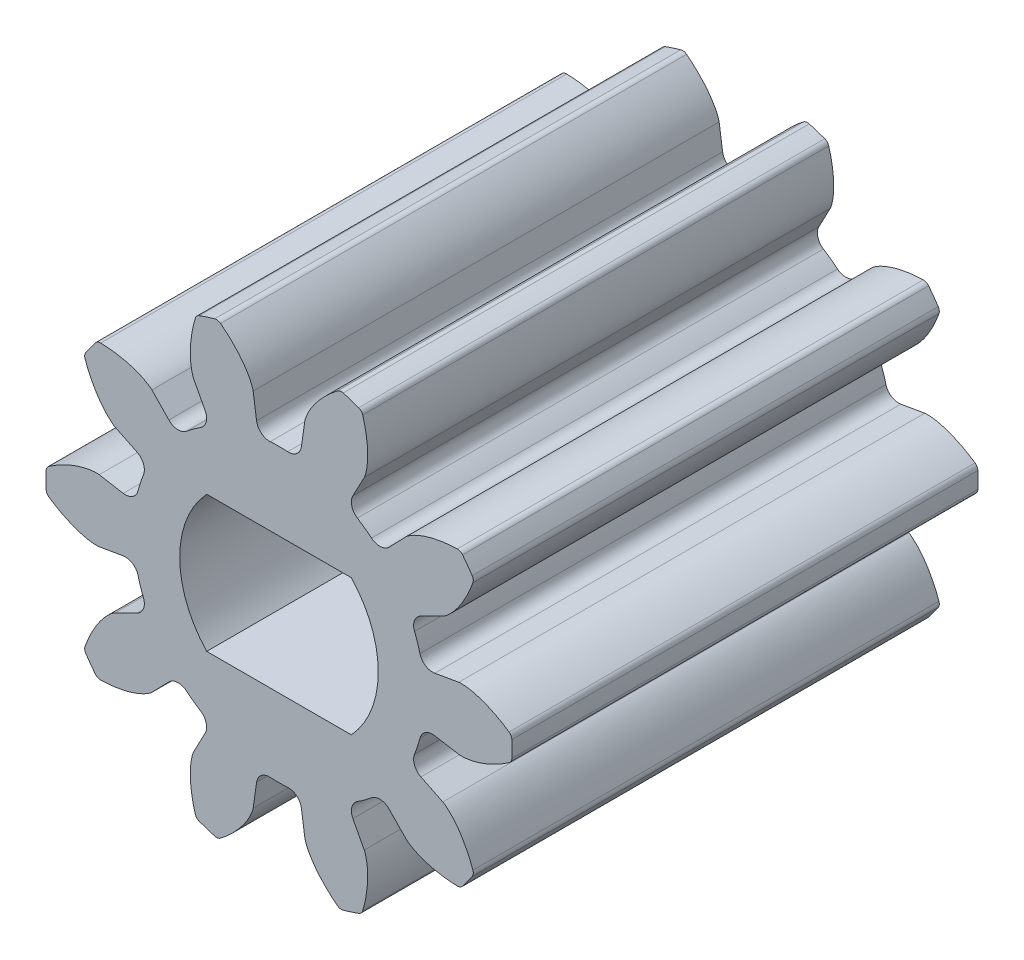
from build123d import *

# Parameters (mm, degrees)
SKETCH1_R                                 = 6.35
BOSS_EXTRUDE1_DEPTH                       = 12.7
CUT_EXTRUDE_DCLTBC_DEPTH                  = 16.554259867
FILLET_TIP_DCLTBC_R                       = 0.177538081
FILLET_ROOT_DCLTBC_R                      = 0.355076163
CIRPATTERN_DCLTBC_COUNT                   = 10
FILLET_TIP_DCLTBC_OF_CIRPATTERN_DCLTBC_R  = 0.177538081
FILLET_ROOT_DCLTBC_OF_CIRPATTERN_DCLTBC_R = 0.355076163
CUT_EXTRUDE2_DEPTH                        = 16.458216095


with BuildPart() as part:
    # Sketch1 → Boss-Extrude1 (new body)
    with BuildSketch(Plane.XY):
        Circle(SKETCH1_R)
    extrude(amount=BOSS_EXTRUDE1_DEPTH)

    # DCLTBC → Cut-Extrude-DCLTBC (cut, through all)
    with BuildSketch(Plane.XY):
        with BuildLine():
            Line((-0.704592769, 4.922367749), (-0.562358973, 3.92870576))
            ThreePointArc((-0.562358973, 3.92870576), (0, 3.96875), (0.562358973, 3.92870576))
            Line((0.562358973, 3.92870576), (0.704592769, 4.922367749))
            add(Edge.make_bspline(
                [(0.704592769, 4.922367749), (0.704959911, 4.924657652), (0.706108696, 4.931060486), (0.708749985, 4.9430835), (0.713722219, 4.962562731), (0.72102673, 4.987160391), (0.731572349, 5.01866565), (0.745406167, 5.05537935), (0.762074788, 5.095269011), (0.781776183, 5.138134197), (0.802804874, 5.18039699), (0.82504792, 5.222061634), (0.848339645, 5.263102092), (0.87787829, 5.312237624), (0.915131441, 5.370333793), (0.961301537, 5.436965609), (1.016733636, 5.510974525), (1.076438178, 5.584628915), (1.137804354, 5.65561363), (1.202739614, 5.72552362), (1.267642643, 5.791874617), (1.337964359, 5.858824087), (1.404363156, 5.919628028), (1.481874196, 5.98546848), (1.545347028, 6.037944392), (1.613447979, 6.090182881), (1.646963442, 6.115313985), (1.664246535, 6.128032594)],
                knots=[0, 0, 0, 0, 0, 0.005376749, 0.015083688, 0.02853182, 0.046610139, 0.064854849, 0.092110525, 0.119476176, 0.146842496, 0.174208854, 0.201574956, 0.228941013, 0.256307345, 0.307035032, 0.361767352, 0.41649966, 0.471231936, 0.525964282, 0.580696615, 0.635428982, 0.690161387, 0.744893688, 0.799626082, 0.854358408, 0.909090915, 0.909090915, 0.909090915, 0.909090915, 0.909090915], degree=4))
            ThreePointArc((1.664246535, 6.128032594), (0, 6.35), (-1.664246535, 6.128032594))
            add(Edge.make_bspline(
                [(-0.704592769, 4.922367749), (-0.704959911, 4.924657652), (-0.706108696, 4.931060486), (-0.708749985, 4.9430835), (-0.713722219, 4.962562731), (-0.72102673, 4.987160391), (-0.731572349, 5.01866565), (-0.745406167, 5.05537935), (-0.762074788, 5.095269011), (-0.781776183, 5.138134197), (-0.802804874, 5.18039699), (-0.82504792, 5.222061634), (-0.848339645, 5.263102092), (-0.87787829, 5.312237624), (-0.915131441, 5.370333793), (-0.961301537, 5.436965609), (-1.016733636, 5.510974525), (-1.076438178, 5.584628915), (-1.137804354, 5.65561363), (-1.202739614, 5.72552362), (-1.267642643, 5.791874617), (-1.337964359, 5.858824087), (-1.404363156, 5.919628028), (-1.481874196, 5.98546848), (-1.545347028, 6.037944392), (-1.613447979, 6.090182881), (-1.646963442, 6.115313985), (-1.664246535, 6.128032594)],
                knots=[0, 0, 0, 0, 0, 0.005376749, 0.015083688, 0.02853182, 0.046610139, 0.064854849, 0.092110525, 0.119476176, 0.146842496, 0.174208854, 0.201574956, 0.228941013, 0.256307345, 0.307035032, 0.361767352, 0.41649966, 0.471231936, 0.525964282, 0.580696615, 0.635428982, 0.690161387, 0.744893688, 0.799626082, 0.854358408, 0.909090915, 0.909090915, 0.909090915, 0.909090915, 0.909090915], degree=4))
        make_face()
    cut_extrude_dcltbc = extrude(amount=CUT_EXTRUDE_DCLTBC_DEPTH, mode=Mode.SUBTRACT)

    # Fillet-Tip-DCLTBC
    fillet_tip_dcltbc_edges = [part.edges().sort_by_distance(p)[0] for p in [
        (1.664246535, 6.128032594, 6.35),
        (-1.664246535, 6.128032594, 6.35),
    ]]
    fillet(fillet_tip_dcltbc_edges, radius=FILLET_TIP_DCLTBC_R)

    # Fillet-Root-DCLTBC
    fillet_root_dcltbc_edges = [part.edges().sort_by_distance(p)[0] for p in [
        (0.562358973, 3.92870576, 6.35),
        (-0.562358973, 3.92870576, 6.35),
    ]]
    fillet(fillet_root_dcltbc_edges, radius=FILLET_ROOT_DCLTBC_R)

    # CirPattern-DCLTBC: Cut-Extrude-DCLTBC ×10 about axis
    cirpattern_dcltbc_axis = Axis((0, 0, 12.7), (0, 0, 1))
    for i in range(1, CIRPATTERN_DCLTBC_COUNT):
        add(cut_extrude_dcltbc.rotate(cirpattern_dcltbc_axis, i * 360 / CIRPATTERN_DCLTBC_COUNT), mode=Mode.SUBTRACT)

    # Fillet-Tip-DCLTBC of CirPattern-DCLTBC
    fillet_tip_dcltbc_of_cirpattern_dcltbc_edges = [part.edges().sort_by_distance(p)[0] for p in [
        (-2.255563455, 5.93590208, 6.35),
        (-4.948370914, 3.979462941, 6.35),
        (-5.313824869, 3.476458725, 6.35),
        (-6.342385793, 0.310873702, 6.35),
        (-6.342385793, -0.310873702, 6.35),
        (-5.313824869, -3.476458725, 6.35),
        (-4.948370914, -3.979462941, 6.35),
        (-2.255563455, -5.93590208, 6.35),
        (-1.664246535, -6.128032594, 6.35),
        (1.664246535, -6.128032594, 6.35),
        (2.255563455, -5.93590208, 6.35),
        (4.948370914, -3.979462941, 6.35),
        (5.313824869, -3.476458725, 6.35),
        (6.342385793, -0.310873702, 6.35),
        (6.342385793, 0.310873702, 6.35),
        (5.313824869, 3.476458725, 6.35),
        (4.948370914, 3.979462941, 6.35),
        (2.255563455, 5.93590208, 6.35),
    ]]
    fillet(fillet_tip_dcltbc_of_cirpattern_dcltbc_edges, radius=FILLET_TIP_DCLTBC_OF_CIRPATTERN_DCLTBC_R)

    # Fillet-Root-DCLTBC of CirPattern-DCLTBC
    fillet_root_dcltbc_of_cirpattern_dcltbc_edges = [part.edges().sort_by_distance(p)[0] for p in [
        (-1.854277341, 3.508936036, 6.35),
        (-2.764193272, 2.847843415, 6.35),
        (-3.562642734, 1.748872011, 6.35),
        (-3.910199693, 0.67920168, 6.35),
        (-3.910199693, -0.67920168, 6.35),
        (-3.562642734, -1.748872011, 6.35),
        (-2.764193272, -2.847843415, 6.35),
        (-1.854277341, -3.508936036, 6.35),
        (-0.562358973, -3.92870576, 6.35),
        (0.562358973, -3.92870576, 6.35),
        (1.854277341, -3.508936036, 6.35),
        (2.764193272, -2.847843415, 6.35),
        (3.562642734, -1.748872011, 6.35),
        (3.910199693, -0.67920168, 6.35),
        (3.910199693, 0.67920168, 6.35),
        (3.562642734, 1.748872011, 6.35),
        (2.764193272, 2.847843415, 6.35),
        (1.854277341, 3.508936036, 6.35),
    ]]
    fillet(fillet_root_dcltbc_of_cirpattern_dcltbc_edges, radius=FILLET_ROOT_DCLTBC_OF_CIRPATTERN_DCLTBC_R)

    # Sketch4 → Cut-Extrude2 (cut, through all)
    with BuildSketch(Plane.XY.offset(12.7)):
        with BuildLine():
            Line((1.969646763, 1.8542), (-1.969646763, 1.8542))
            ThreePointArc((-1.969646763, 1.8542), (-2.7051, 0), (-1.969646763, -1.8542))
            Line((-1.969646763, -1.8542), (1.969646763, -1.8542))
            ThreePointArc((1.969646763, -1.8542), (2.51452356, -0.997365167), (2.7051, 0))
            ThreePointArc((2.7051, 0), (2.51452356, 0.997365167), (1.969646763, 1.8542))
        make_face()
    extrude(amount=-CUT_EXTRUDE2_DEPTH, mode=Mode.SUBTRACT)


solid = part.part
